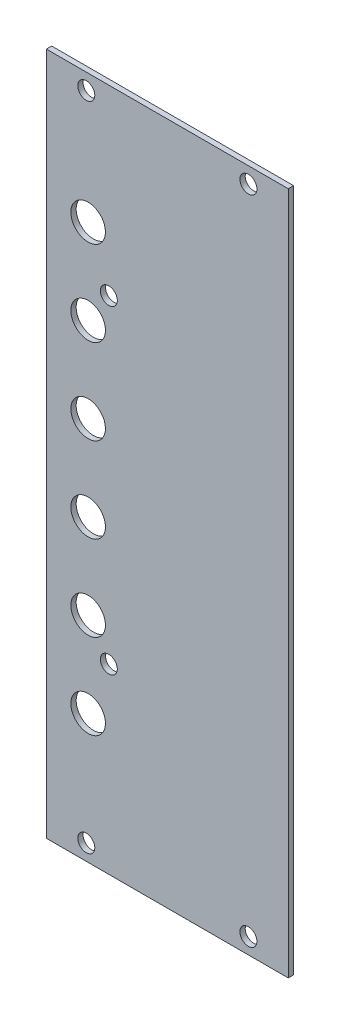
from build123d import *

# Parameters (mm, degrees)
SKETCH2_W                        = 45.48
SKETCH2_H                        = 128.5
SKETCH2_R                        = 1.6
BOSS_EXTRUDE1_DEPTH              = 1
SMA_CUTS_DEPTH                   = 137.314637512
SMA_CUTS_DEPTH_BACK              = 137.314637512
SKETCH3_R                        = 3.25
MOUNTING_BRACKET_CUTS_DEPTH      = 137.314637512
MOUNTING_BRACKET_CUTS_DEPTH_BACK = 137.314637512
SKETCH4_R                        = 1.6


with BuildPart() as part:
    # Sketch2 → Boss-Extrude1 (new body)
    with BuildSketch(Plane.XY):
        with Locations((22.74, 64.25)):
            Rectangle(SKETCH2_W, SKETCH2_H)
        with Locations((7.5, 3)):
            Circle(SKETCH2_R, mode=Mode.SUBTRACT)
        with Locations((37.98, 3)):
            Circle(SKETCH2_R, mode=Mode.SUBTRACT)
        with Locations((37.98, 125.5)):
            Circle(SKETCH2_R, mode=Mode.SUBTRACT)
        with Locations((7.5, 125.5)):
            Circle(SKETCH2_R, mode=Mode.SUBTRACT)
    extrude(amount=BOSS_EXTRUDE1_DEPTH)

    # Sketch3 → sma_cuts (cut, two sides: drawn at the far end of the back side and taken through both)
    with BuildSketch(Plane.XY.offset(1).offset(-SMA_CUTS_DEPTH_BACK)):
        with Locations((7.85, 104.25)):
            Circle(SKETCH3_R)
        with Locations((7.85, 88.25)):
            Circle(SKETCH3_R)
        with Locations((7.85, 72.25)):
            Circle(SKETCH3_R)
        with Locations((7.85, 56.25)):
            Circle(SKETCH3_R)
        with Locations((7.85, 40.25)):
            Circle(SKETCH3_R)
        with Locations((7.85, 24.25)):
            Circle(SKETCH3_R)
    extrude(amount=SMA_CUTS_DEPTH + SMA_CUTS_DEPTH_BACK, mode=Mode.SUBTRACT)

    # Sketch4 → mounting_bracket_cuts (cut, two sides: drawn at the far end of the back side and taken through both)
    with BuildSketch(Plane.XY.offset(1).offset(-MOUNTING_BRACKET_CUTS_DEPTH_BACK)):
        with Locations((11.7314, 94.225)):
            Circle(SKETCH4_R)
        with Locations((11.7314, 34.225)):
            Circle(SKETCH4_R)
    extrude(amount=MOUNTING_BRACKET_CUTS_DEPTH + MOUNTING_BRACKET_CUTS_DEPTH_BACK, mode=Mode.SUBTRACT)


solid = part.part
